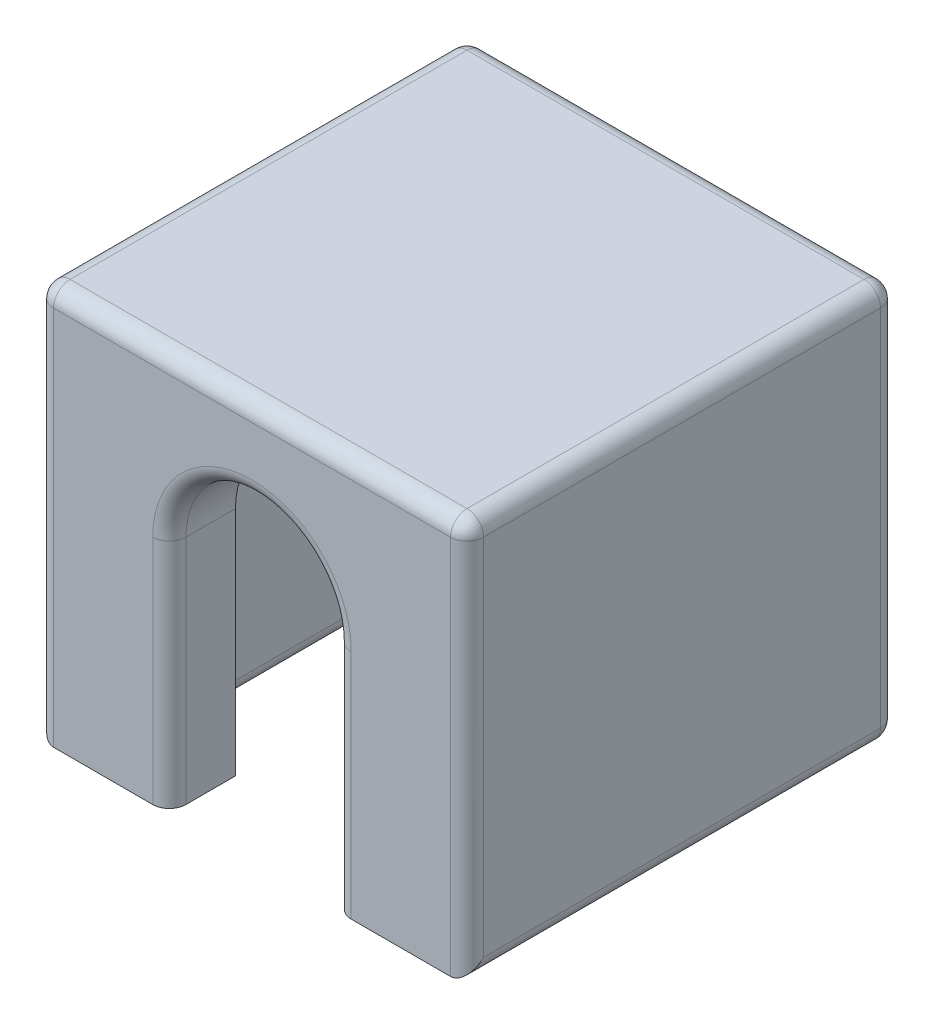
from build123d import *

# Parameters (mm, degrees)
SKETCH1_W           = 1981.2
SKETCH1_H           = 1981.2
BOSS_EXTRUDE1_DEPTH = 1828.8
CUT_EXTRUDE1_DEPTH  = 1371.6
SKETCH3_W           = 1371.6
SKETCH3_H           = 1371.6
CUT_EXTRUDE2_DEPTH  = 3346.865556175
SKETCH4_W           = 609.6
SKETCH4_H           = 609.6
CUT_EXTRUDE3_DEPTH  = 304.8
SKETCH5_W           = 1981.2
SKETCH5_H           = 304.8
BOSS_EXTRUDE2_DEPTH = 1676.4
FILLET1_R           = 76.2


with BuildPart() as part:
    # Sketch1 → Boss-Extrude1 (new body)
    with BuildSketch(Plane(origin=(0, 0, 0), x_dir=(1, 0, 0), z_dir=(0, 1, 0))):
        with Locations((990.6, 990.6)):
            Rectangle(SKETCH1_W, SKETCH1_H)
    extrude(amount=BOSS_EXTRUDE1_DEPTH)

    # Sketch2 → Cut-Extrude1 (cut)
    with BuildSketch(Plane.XY):
        with BuildLine():
            Line((609.6, 0), (1371.6, 0))
            Line((1371.6, 0), (1371.6, 1066.8))
            ThreePointArc((1371.6, 1066.8), (990.6, 1447.8), (609.6, 1066.8))
            Line((609.6, 1066.8), (609.6, 0))
        make_face()
    extrude(amount=-CUT_EXTRUDE1_DEPTH, mode=Mode.SUBTRACT)

    # Sketch3 → Cut-Extrude2 (cut, through all)
    with BuildSketch(Plane(origin=(0, 1828.8, 0), x_dir=(1, 0, 0), z_dir=(0, 1, 0))):
        with Locations((990.6, 990.6)):
            Rectangle(SKETCH3_W, SKETCH3_H)
    extrude(amount=-CUT_EXTRUDE2_DEPTH, mode=Mode.SUBTRACT)

    # Sketch4 → Cut-Extrude3 (cut)
    with BuildSketch(Plane(origin=(0, 0, -1981.2), x_dir=(-1, 0, 0), z_dir=(0, 0, -1))):
        with Locations((-990.6, 914.4)):
            Rectangle(SKETCH4_W, SKETCH4_H)
    extrude(amount=-CUT_EXTRUDE3_DEPTH, mode=Mode.SUBTRACT)

    # Sketch5 → Boss-Extrude2 (add)
    with BuildSketch(Plane(origin=(1981.2, 0, 0), x_dir=(0, 0, -1), z_dir=(1, 0, 0))):
        with Locations((990.6, 1676.4)):
            Rectangle(SKETCH5_W, SKETCH5_H)
    extrude(amount=-BOSS_EXTRUDE2_DEPTH)

    # Fillet1
    fillet1_edges = [part.edges().sort_by_distance(p)[0] for p in [
        (1981.2, 1828.8, -990.6),
        (990.6, 1828.8, -1981.2),
        (609.6, 533.4, 0),
        (1371.6, 533.4, 0),
        (990.6, 1447.8, 0),
        (990.6, 0, -1676.4),
        (304.8, 762, -1676.4),
        (1676.4, 0, -990.6),
        (1676.4, 762, -1676.4),
        (304.8, 0, -990.6),
        (0, 1828.8, -990.6),
        (990.6, 0, -1981.2),
        (1981.2, 0, -990.6),
        (990.6, 609.6, -1981.2),
        (1295.4, 914.4, -1981.2),
        (685.8, 914.4, -1676.4),
        (685.8, 914.4, -1981.2),
        (990.6, 1219.2, -1676.4),
        (990.6, 1219.2, -1981.2),
        (990.6, 609.6, -1676.4),
        (1295.4, 914.4, -1676.4),
        (0, 0, -990.6),
        (990.6, 1828.8, 0),
        (990.6, 1524, -1676.4),
        (0, 914.4, -1981.2),
        (1981.2, 914.4, -1981.2),
        (1981.2, 914.4, 0),
        (0, 914.4, 0),
    ]]
    fillet(fillet1_edges, radius=FILLET1_R)


solid = part.part
